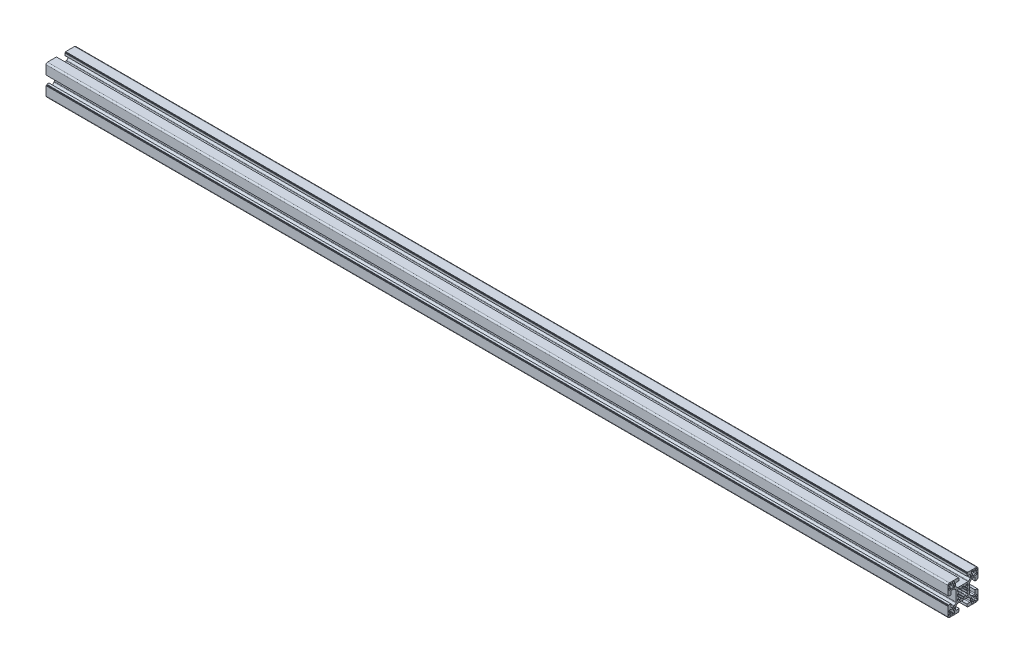
from build123d import *

# Parameters (mm, degrees)
C_PROGRAM_FILES_SOLIDWORKS_CORP_SOLIDWOR_DEPTH = 1200


with BuildPart() as part:
    # Sketch1 → C_PROGRAM FILES_SOLIDWORKS CORP_SOLIDWOR (new body)
    with BuildSketch(Plane(origin=(-1068.949287205, 47.008732953, 0), x_dir=(0, 0, -1), z_dir=(1, 0, 0))):
        with BuildLine():
            Line((-20, 18), (-20, 6.1))
            Line((-20, 6.1), (-19, 6.1))
            Line((-19, 6.1), (-19, 5.1))
            Line((-19, 5.1), (-16, 5.1))
            Line((-16, 5.1), (-16, 9))
            ThreePointArc((-16, 9), (-15.707106781, 9.707106781), (-15, 10))
            Line((-15, 10), (-12.181980515, 10))
            ThreePointArc((-12.181980515, 10), (-11.799297083, 9.923879533), (-11.474873734, 9.707106781))
            Line((-11.474873734, 9.707106781), (-9.292893219, 7.525126266))
            ThreePointArc((-9.292893219, 7.525126266), (-9.076120467, 7.200702917), (-9, 6.818019485))
            Line((-9, 6.818019485), (-9, -6.818019485))
            ThreePointArc((-9, -6.818019485), (-9.076120467, -7.200702917), (-9.292893219, -7.525126266))
            Line((-9.292893219, -7.525126266), (-11.474873734, -9.707106781))
            ThreePointArc((-11.474873734, -9.707106781), (-11.799297083, -9.923879533), (-12.181980515, -10))
            Line((-12.181980515, -10), (-15, -10))
            ThreePointArc((-15, -10), (-15.707106781, -9.707106781), (-16, -9))
            Line((-16, -9), (-16, -5.1))
            Line((-16, -5.1), (-19, -5.1))
            Line((-19, -5.1), (-19, -6.1))
            Line((-19, -6.1), (-20, -6.1))
            Line((-20, -6.1), (-20, -18))
            ThreePointArc((-20, -18), (-19.414213562, -19.414213562), (-18, -20))
            Line((-18, -20), (-6.1, -20))
            Line((-6.1, -20), (-6.1, -19))
            Line((-6.1, -19), (-5.1, -19))
            Line((-5.1, -19), (-5.1, -16))
            Line((-5.1, -16), (-9, -16))
            ThreePointArc((-9, -16), (-9.707106781, -15.707106781), (-10, -15))
            Line((-10, -15), (-10, -12.181980515))
            ThreePointArc((-10, -12.181980515), (-9.923879533, -11.799297083), (-9.707106781, -11.474873734))
            Line((-9.707106781, -11.474873734), (-7.525126266, -9.292893219))
            ThreePointArc((-7.525126266, -9.292893219), (-7.200702917, -9.076120467), (-6.818019485, -9))
            Line((-6.818019485, -9), (6.818019485, -9))
            ThreePointArc((6.818019485, -9), (7.200702917, -9.076120467), (7.525126266, -9.292893219))
            Line((7.525126266, -9.292893219), (9.707106781, -11.474873734))
            ThreePointArc((9.707106781, -11.474873734), (9.923879533, -11.799297083), (10, -12.181980515))
            Line((10, -12.181980515), (10, -15))
            ThreePointArc((10, -15), (9.707106781, -15.707106781), (9, -16))
            Line((9, -16), (5.1, -16))
            Line((5.1, -16), (5.1, -19))
            Line((5.1, -19), (6.1, -19))
            Line((6.1, -19), (6.1, -20))
            Line((6.1, -20), (18, -20))
            ThreePointArc((18, -20), (19.414213562, -19.414213562), (20, -18))
            Line((20, -18), (20, -6.1))
            Line((20, -6.1), (19, -6.1))
            Line((19, -6.1), (19, -5.1))
            Line((19, -5.1), (16, -5.1))
            Line((16, -5.1), (16, -9))
            ThreePointArc((16, -9), (15.707106781, -9.707106781), (15, -10))
            Line((15, -10), (12.181980515, -10))
            ThreePointArc((12.181980515, -10), (11.799297083, -9.923879533), (11.474873734, -9.707106781))
            Line((11.474873734, -9.707106781), (9.292893219, -7.525126266))
            ThreePointArc((9.292893219, -7.525126266), (9.076120467, -7.200702917), (9, -6.818019485))
            Line((9, -6.818019485), (9, 6.818019485))
            ThreePointArc((9, 6.818019485), (9.076120467, 7.200702917), (9.292893219, 7.525126266))
            Line((9.292893219, 7.525126266), (11.474873734, 9.707106781))
            ThreePointArc((11.474873734, 9.707106781), (11.799297083, 9.923879533), (12.181980515, 10))
            Line((12.181980515, 10), (15, 10))
            ThreePointArc((15, 10), (15.707106781, 9.707106781), (16, 9))
            Line((16, 9), (16, 5.1))
            Line((16, 5.1), (19, 5.1))
            Line((19, 5.1), (19, 6.1))
            Line((19, 6.1), (20, 6.1))
            Line((20, 6.1), (20, 18))
            ThreePointArc((20, 18), (19.414213562, 19.414213562), (18, 20))
            Line((18, 20), (6.1, 20))
            Line((6.1, 20), (6.1, 19))
            Line((6.1, 19), (5.1, 19))
            Line((5.1, 19), (5.1, 16))
            Line((5.1, 16), (9, 16))
            ThreePointArc((9, 16), (9.707106781, 15.707106781), (10, 15))
            Line((10, 15), (10, 12.181980515))
            ThreePointArc((10, 12.181980515), (9.923879533, 11.799297083), (9.707106781, 11.474873734))
            Line((9.707106781, 11.474873734), (7.525126266, 9.292893219))
            ThreePointArc((7.525126266, 9.292893219), (7.200702917, 9.076120467), (6.818019485, 9))
            Line((6.818019485, 9), (-6.818019485, 9))
            ThreePointArc((-6.818019485, 9), (-7.200702917, 9.076120467), (-7.525126266, 9.292893219))
            Line((-7.525126266, 9.292893219), (-9.707106781, 11.474873734))
            ThreePointArc((-9.707106781, 11.474873734), (-9.923879533, 11.799297083), (-10, 12.181980515))
            Line((-10, 12.181980515), (-10, 15))
            ThreePointArc((-10, 15), (-9.707106781, 15.707106781), (-9, 16))
            Line((-9, 16), (-5.1, 16))
            Line((-5.1, 16), (-5.1, 19))
            Line((-5.1, 19), (-6.1, 19))
            Line((-6.1, 19), (-6.1, 20))
            Line((-6.1, 20), (-18, 20))
            ThreePointArc((-18, 20), (-19.414213562, 19.414213562), (-20, 18))
        make_face()
        with BuildLine():
            Line((-15.8, 18.5), (-15.8, 16.869681569))
            Line((-15.8, 16.869681569), (-14.2, 16.869681569))
            Line((-14.2, 16.869681569), (-14.2, 18.5))
            Line((-14.2, 18.5), (-11.5, 18.5))
            Line((-11.5, 18.5), (-11.5, 15.169681569))
            Line((-11.5, 15.169681569), (-12.5, 15.169681569))
            Line((-12.5, 15.169681569), (-12.5, 13.569681569))
            Line((-12.5, 13.569681569), (-11.5, 13.569681569))
            Line((-11.5, 13.569681569), (-11.5, 11.5))
            Line((-11.5, 11.5), (-14.2, 11.5))
            Line((-14.2, 11.5), (-14.2, 12.5))
            Line((-14.2, 12.5), (-15.8, 12.5))
            Line((-15.8, 12.5), (-15.8, 11.5))
            Line((-15.8, 11.5), (-18.5, 11.5))
            Line((-18.5, 11.5), (-18.5, 14.2))
            Line((-18.5, 14.2), (-17.5, 14.2))
            Line((-17.5, 14.2), (-17.5, 15.8))
            Line((-17.5, 15.8), (-18.5, 15.8))
            Line((-18.5, 15.8), (-18.5, 17.5))
            ThreePointArc((-18.5, 17.5), (-18.207106781, 18.207106781), (-17.5, 18.5))
            Line((-17.5, 18.5), (-15.8, 18.5))
        make_face(mode=Mode.SUBTRACT)
        with BuildLine():
            Line((17.5, 18.5), (15.8, 18.5))
            Line((15.8, 18.5), (15.8, 16.869681569))
            Line((15.8, 16.869681569), (14.2, 16.869681569))
            Line((14.2, 16.869681569), (14.2, 18.5))
            Line((14.2, 18.5), (11.5, 18.5))
            Line((11.5, 18.5), (11.5, 15.169681569))
            Line((11.5, 15.169681569), (12.5, 15.169681569))
            Line((12.5, 15.169681569), (12.5, 13.569681569))
            Line((12.5, 13.569681569), (11.5, 13.569681569))
            Line((11.5, 13.569681569), (11.5, 11.5))
            Line((11.5, 11.5), (14.2, 11.5))
            Line((14.2, 11.5), (14.2, 12.5))
            Line((14.2, 12.5), (15.8, 12.5))
            Line((15.8, 12.5), (15.8, 11.5))
            Line((15.8, 11.5), (18.5, 11.5))
            Line((18.5, 11.5), (18.5, 14.2))
            Line((18.5, 14.2), (17.5, 14.2))
            Line((17.5, 14.2), (17.5, 15.8))
            Line((17.5, 15.8), (18.5, 15.8))
            Line((18.5, 15.8), (18.5, 17.5))
            ThreePointArc((18.5, 17.5), (18.207106781, 18.207106781), (17.5, 18.5))
        make_face(mode=Mode.SUBTRACT)
        with BuildLine():
            Line((15.8, -18.5), (15.8, -16.869681569))
            Line((15.8, -16.869681569), (14.2, -16.869681569))
            Line((14.2, -16.869681569), (14.2, -18.5))
            Line((14.2, -18.5), (11.5, -18.5))
            Line((11.5, -18.5), (11.5, -15.169681569))
            Line((11.5, -15.169681569), (12.5, -15.169681569))
            Line((12.5, -15.169681569), (12.5, -13.569681569))
            Line((12.5, -13.569681569), (11.5, -13.569681569))
            Line((11.5, -13.569681569), (11.5, -11.5))
            Line((11.5, -11.5), (14.2, -11.5))
            Line((14.2, -11.5), (14.2, -12.5))
            Line((14.2, -12.5), (15.8, -12.5))
            Line((15.8, -12.5), (15.8, -11.5))
            Line((15.8, -11.5), (18.5, -11.5))
            Line((18.5, -11.5), (18.5, -14.2))
            Line((18.5, -14.2), (17.5, -14.2))
            Line((17.5, -14.2), (17.5, -15.8))
            Line((17.5, -15.8), (18.5, -15.8))
            Line((18.5, -15.8), (18.5, -17.5))
            ThreePointArc((18.5, -17.5), (18.207106781, -18.207106781), (17.5, -18.5))
            Line((17.5, -18.5), (15.8, -18.5))
        make_face(mode=Mode.SUBTRACT)
        with BuildLine():
            Line((-17.5, -18.5), (-15.8, -18.5))
            Line((-15.8, -18.5), (-15.8, -16.869681569))
            Line((-15.8, -16.869681569), (-14.2, -16.869681569))
            Line((-14.2, -16.869681569), (-14.2, -18.5))
            Line((-14.2, -18.5), (-11.5, -18.5))
            Line((-11.5, -18.5), (-11.5, -15.169681569))
            Line((-11.5, -15.169681569), (-12.5, -15.169681569))
            Line((-12.5, -15.169681569), (-12.5, -13.569681569))
            Line((-12.5, -13.569681569), (-11.5, -13.569681569))
            Line((-11.5, -13.569681569), (-11.5, -11.5))
            Line((-11.5, -11.5), (-14.2, -11.5))
            Line((-14.2, -11.5), (-14.2, -12.5))
            Line((-14.2, -12.5), (-15.8, -12.5))
            Line((-15.8, -12.5), (-15.8, -11.5))
            Line((-15.8, -11.5), (-18.5, -11.5))
            Line((-18.5, -11.5), (-18.5, -14.2))
            Line((-18.5, -14.2), (-17.5, -14.2))
            Line((-17.5, -14.2), (-17.5, -15.8))
            Line((-17.5, -15.8), (-18.5, -15.8))
            Line((-18.5, -15.8), (-18.5, -17.5))
            ThreePointArc((-18.5, -17.5), (-18.207106781, -18.207106781), (-17.5, -18.5))
        make_face(mode=Mode.SUBTRACT)
        with BuildLine():
            Line((-7, 4.2), (-6.179898987, 4.2))
            Line((-6.179898987, 4.2), (-5.115479763, 3.135580775))
            Line((-5.115479763, 3.135580775), (-5.543277195, 2.296100594))
            Line((-5.543277195, 2.296100594), (-5.834380858, 1.4))
            Line((-5.834380858, 1.4), (-7, 1.4))
            Line((-7, 1.4), (-7, -1.4))
            Line((-7, -1.4), (-5.834380858, -1.4))
            Line((-5.834380858, -1.4), (-5.543277195, -2.296100594))
            Line((-5.543277195, -2.296100594), (-5.115479763, -3.135580775))
            Line((-5.115479763, -3.135580775), (-6.179898987, -4.2))
            Line((-6.179898987, -4.2), (-7, -4.2))
            Line((-7, -4.2), (-7, -6))
            ThreePointArc((-7, -6), (-6.707106781, -6.707106781), (-6, -7))
            Line((-6, -7), (-4.2, -7))
            Line((-4.2, -7), (-4.2, -6.179898987))
            Line((-4.2, -6.179898987), (-3.135580775, -5.115479763))
            Line((-3.135580775, -5.115479763), (-2.296100594, -5.543277195))
            Line((-2.296100594, -5.543277195), (-1.4, -5.834380858))
            Line((-1.4, -5.834380858), (-1.4, -7))
            Line((-1.4, -7), (1.4, -7))
            Line((1.4, -7), (1.4, -5.834380858))
            Line((1.4, -5.834380858), (2.296100594, -5.543277195))
            Line((2.296100594, -5.543277195), (3.135580775, -5.115479763))
            Line((3.135580775, -5.115479763), (4.2, -6.179898987))
            Line((4.2, -6.179898987), (4.2, -7))
            Line((4.2, -7), (6, -7))
            ThreePointArc((6, -7), (6.707106781, -6.707106781), (7, -6))
            Line((7, -6), (7, -4.2))
            Line((7, -4.2), (6.179898987, -4.2))
            Line((6.179898987, -4.2), (5.115479763, -3.135580775))
            Line((5.115479763, -3.135580775), (5.543277195, -2.296100594))
            Line((5.543277195, -2.296100594), (5.834380858, -1.4))
            Line((5.834380858, -1.4), (7, -1.4))
            Line((7, -1.4), (7, 1.4))
            Line((7, 1.4), (5.834380858, 1.4))
            Line((5.834380858, 1.4), (5.543277195, 2.296100594))
            Line((5.543277195, 2.296100594), (5.115479763, 3.135580775))
            Line((5.115479763, 3.135580775), (6.179898987, 4.2))
            Line((6.179898987, 4.2), (7, 4.2))
            Line((7, 4.2), (7, 6))
            ThreePointArc((7, 6), (6.707106781, 6.707106781), (6, 7))
            Line((6, 7), (4.2, 7))
            Line((4.2, 7), (4.2, 6.179898987))
            Line((4.2, 6.179898987), (3.135580775, 5.115479763))
            Line((3.135580775, 5.115479763), (2.296100594, 5.543277195))
            Line((2.296100594, 5.543277195), (1.4, 5.834380858))
            Line((1.4, 5.834380858), (1.4, 7))
            Line((1.4, 7), (-1.4, 7))
            Line((-1.4, 7), (-1.4, 5.834380858))
            Line((-1.4, 5.834380858), (-2.296100594, 5.543277195))
            Line((-2.296100594, 5.543277195), (-3.135580775, 5.115479763))
            Line((-3.135580775, 5.115479763), (-4.2, 6.179898987))
            Line((-4.2, 6.179898987), (-4.2, 7))
            Line((-4.2, 7), (-6, 7))
            ThreePointArc((-6, 7), (-6.707106781, 6.707106781), (-7, 6))
            Line((-7, 6), (-7, 4.2))
        make_face(mode=Mode.SUBTRACT)
    extrude(amount=C_PROGRAM_FILES_SOLIDWORKS_CORP_SOLIDWOR_DEPTH)


solid = part.part
